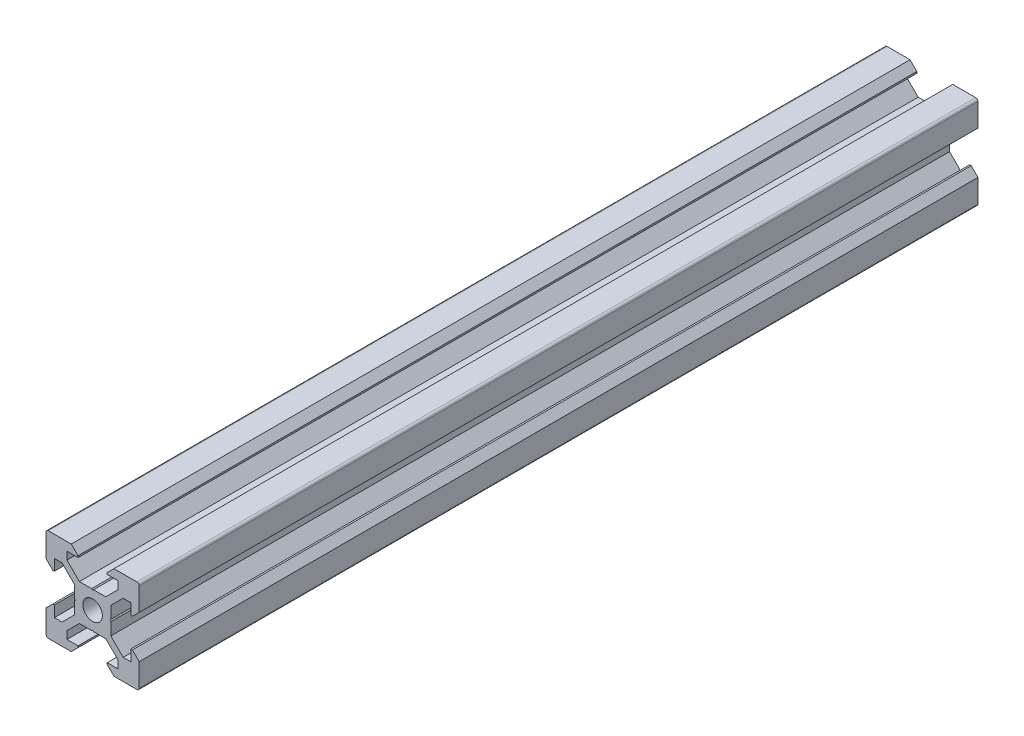
from build123d import *

# Parameters (mm, degrees)
SKETCH1_R           = 2.1
BOSS_EXTRUDE1_DEPTH = 180


with BuildPart() as part:
    # Sketch1 → Boss-Extrude1 (new body)
    with BuildSketch(Plane.XY):
        with BuildLine():
            Line((4.58, -10), (9.5, -10))
            ThreePointArc((9.5, -10), (9.853553391, -9.853553391), (10, -9.5))
            Line((10, -9.5), (10, -4.58))
            Line((10, -4.58), (8.545, -3.125))
            Line((8.545, -3.125), (8.2, -3.125))
            Line((8.2, -3.125), (8.2, -5.5))
            Line((8.2, -5.5), (6.560660172, -5.5))
            Line((6.560660172, -5.5), (3.9, -2.839339828))
            Line((3.9, -2.839339828), (3.9, -0.21))
            Line((3.9, -0.21), (3.69, 0))
            Line((3.69, 0), (3.9, 0.21))
            Line((3.9, 0.21), (3.9, 2.839339828))
            Line((3.9, 2.839339828), (6.560660172, 5.5))
            Line((6.560660172, 5.5), (8.2, 5.5))
            Line((8.2, 5.5), (8.2, 3.125))
            Line((8.2, 3.125), (8.545, 3.125))
            Line((8.545, 3.125), (10, 4.58))
            Line((10, 4.58), (10, 9.5))
            ThreePointArc((10, 9.5), (9.853553391, 9.853553391), (9.5, 10))
            Line((9.5, 10), (4.58, 10))
            Line((4.58, 10), (3.125, 8.545))
            Line((3.125, 8.545), (3.125, 8.2))
            Line((3.125, 8.2), (5.5, 8.2))
            Line((5.5, 8.2), (5.5, 6.560660172))
            Line((5.5, 6.560660172), (2.839339828, 3.9))
            Line((2.839339828, 3.9), (0.21, 3.9))
            Line((0.21, 3.9), (0, 3.69))
            Line((0, 3.69), (-0.21, 3.9))
            Line((-0.21, 3.9), (-2.839339828, 3.9))
            Line((-2.839339828, 3.9), (-5.5, 6.560660172))
            Line((-5.5, 6.560660172), (-5.5, 8.2))
            Line((-5.5, 8.2), (-3.125, 8.2))
            Line((-3.125, 8.2), (-3.125, 8.545))
            Line((-3.125, 8.545), (-4.58, 10))
            Line((-4.58, 10), (-9.5, 10))
            ThreePointArc((-9.5, 10), (-9.853553391, 9.853553391), (-10, 9.5))
            Line((-10, 9.5), (-10, 4.58))
            Line((-10, 4.58), (-8.545, 3.125))
            Line((-8.545, 3.125), (-8.2, 3.125))
            Line((-8.2, 3.125), (-8.2, 5.5))
            Line((-8.2, 5.5), (-6.560660172, 5.5))
            Line((-6.560660172, 5.5), (-3.9, 2.839339828))
            Line((-3.9, 2.839339828), (-3.9, 0.21))
            Line((-3.9, 0.21), (-3.69, 0))
            Line((-3.69, 0), (-3.9, -0.21))
            Line((-3.9, -0.21), (-3.9, -2.839339828))
            Line((-3.9, -2.839339828), (-6.560660172, -5.5))
            Line((-6.560660172, -5.5), (-8.2, -5.5))
            Line((-8.2, -5.5), (-8.2, -3.125))
            Line((-8.2, -3.125), (-8.545, -3.125))
            Line((-8.545, -3.125), (-10, -4.58))
            Line((-10, -4.58), (-10, -9.5))
            ThreePointArc((-10, -9.5), (-9.853553391, -9.853553391), (-9.5, -10))
            Line((-9.5, -10), (-4.58, -10))
            Line((-4.58, -10), (-3.125, -8.545))
            Line((-3.125, -8.545), (-3.125, -8.2))
            Line((-3.125, -8.2), (-5.5, -8.2))
            Line((-5.5, -8.2), (-5.5, -6.560660172))
            Line((-5.5, -6.560660172), (-2.839339828, -3.9))
            Line((-2.839339828, -3.9), (-0.21, -3.9))
            Line((-0.21, -3.9), (0, -3.69))
            Line((0, -3.69), (0.21, -3.9))
            Line((0.21, -3.9), (2.839339828, -3.9))
            Line((2.839339828, -3.9), (5.5, -6.560660172))
            Line((5.5, -6.560660172), (5.5, -8.2))
            Line((5.5, -8.2), (3.125, -8.2))
            Line((3.125, -8.2), (3.125, -8.545))
            Line((3.125, -8.545), (4.58, -10))
        make_face()
        with Locations(Location((0, 0, 0), (0, 0, 180))):
            Circle(SKETCH1_R, mode=Mode.SUBTRACT)
    extrude(amount=BOSS_EXTRUDE1_DEPTH)


solid = part.part
